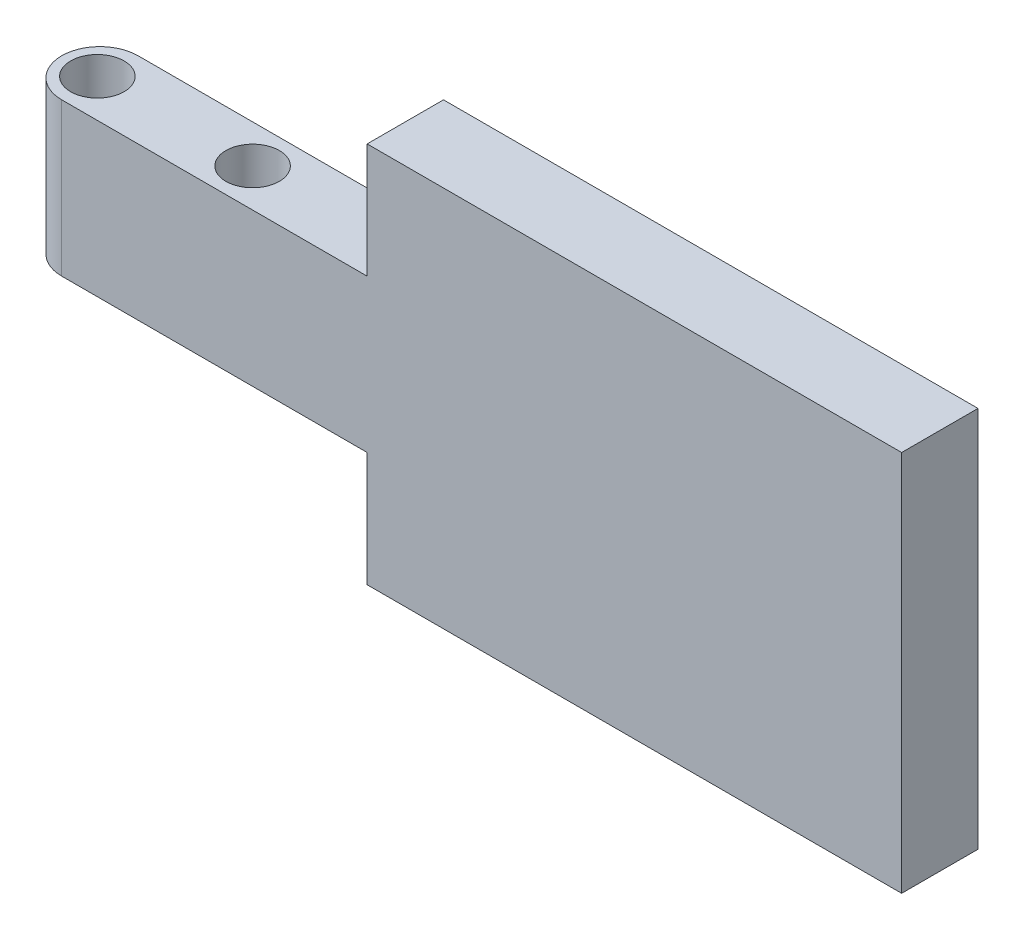
from build123d import *

# Parameters (mm, degrees)
BOSS_EXTRUDE1_DEPTH      = 25
BOSS_EXTRUDE1_DEPTH_BACK = 25
SKETCH1_W                = 70
SKETCH1_H                = 10
BOSS_EXTRUDE2_DEPTH      = 10
BOSS_EXTRUDE2_DEPTH_BACK = 10
CUT_EXTRUDE1_DEPTH       = 19
CUT_EXTRUDE1_DEPTH_BACK  = 16
SKETCH3_R                = 3.5


with BuildPart() as part:
    # Sketch1 → Boss-Extrude1 (new, two sides: drawn at the far end of the back side and taken through both)
    with BuildSketch(Plane(origin=(0, 0, 0), x_dir=(1, 0, 0), z_dir=(0, 1, 0)).offset(-BOSS_EXTRUDE1_DEPTH_BACK)):
        Rectangle(SKETCH1_W, SKETCH1_H)
    extrude(amount=BOSS_EXTRUDE1_DEPTH + BOSS_EXTRUDE1_DEPTH_BACK)

    # Sketch2 → Boss-Extrude2 (add, two sides: drawn at the far end of the back side and taken through both)
    with BuildSketch(Plane(origin=(0, 0, 0), x_dir=(1, 0, 0), z_dir=(0, 1, 0)).offset(-BOSS_EXTRUDE2_DEPTH_BACK)):
        with BuildLine():
            Line((-75, 5), (-35, 5))
            Line((-35, 5), (-35, -5))
            Line((-35, -5), (-75, -5))
            ThreePointArc((-75, -5), (-80, 0), (-75, 5))
        make_face()
    extrude(amount=BOSS_EXTRUDE2_DEPTH + BOSS_EXTRUDE2_DEPTH_BACK)

    # Sketch3 → Cut-Extrude1 (cut, two sides: drawn at the far end of the back side and taken through both)
    with BuildSketch(Plane(origin=(0, 0, 0), x_dir=(1, 0, 0), z_dir=(0, 1, 0)).offset(-CUT_EXTRUDE1_DEPTH_BACK)):
        with Locations((-75.333177097, 0)):
            Circle(SKETCH3_R)
        with Locations((-55, 0)):
            Circle(SKETCH3_R)
    extrude(amount=CUT_EXTRUDE1_DEPTH + CUT_EXTRUDE1_DEPTH_BACK, mode=Mode.SUBTRACT)


solid = part.part
